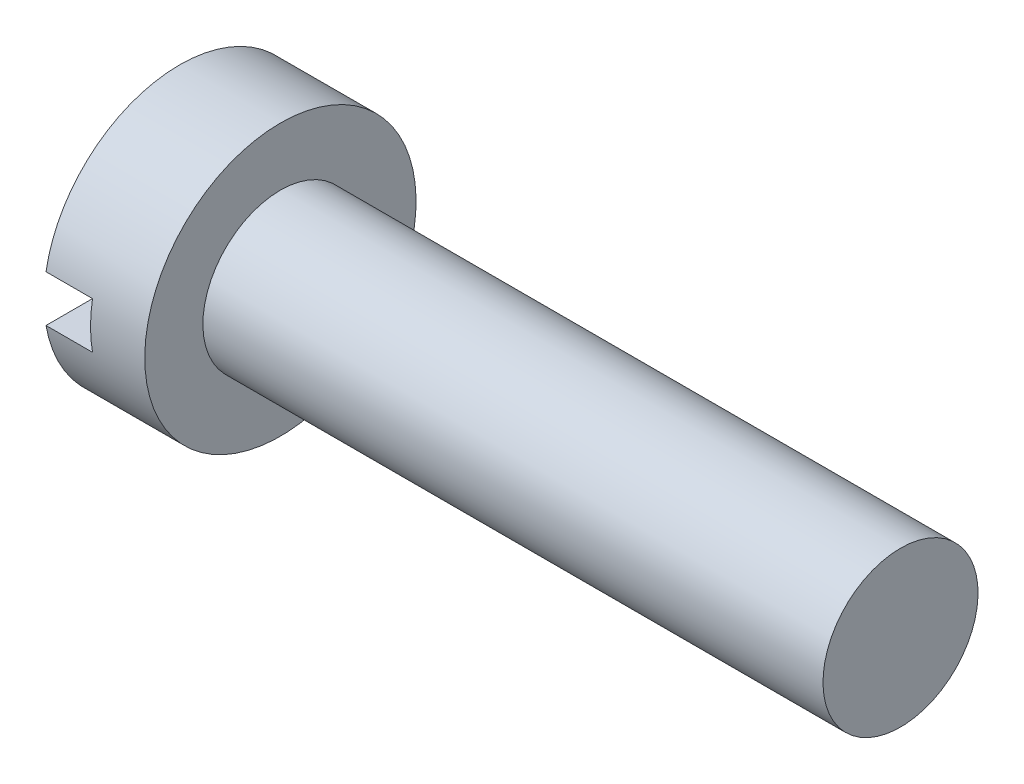
from build123d import *

# Parameters (mm, degrees)
SKETCH2_W          = 7
SKETCH2_H          = 1.2
CUT_EXTRUDE1_DEPTH = 1.2


with BuildPart() as part:
    # Sketch1 → Revolve1 (revolve)
    with BuildSketch(Plane.XY):
        Polygon((0, 0), (0, 3.5), (2.6, 3.5), (2.6, 2), (18.6, 2), (18.6, 0), align=None)
    revolve(axis=Axis((18.6, 0, 0), (-1, 0, 0)))

    # Sketch2 → Cut-Extrude1 (cut)
    with BuildSketch(Plane.ZY):
        Rectangle(SKETCH2_W, SKETCH2_H)
    extrude(amount=-CUT_EXTRUDE1_DEPTH, mode=Mode.SUBTRACT)


solid = part.part
